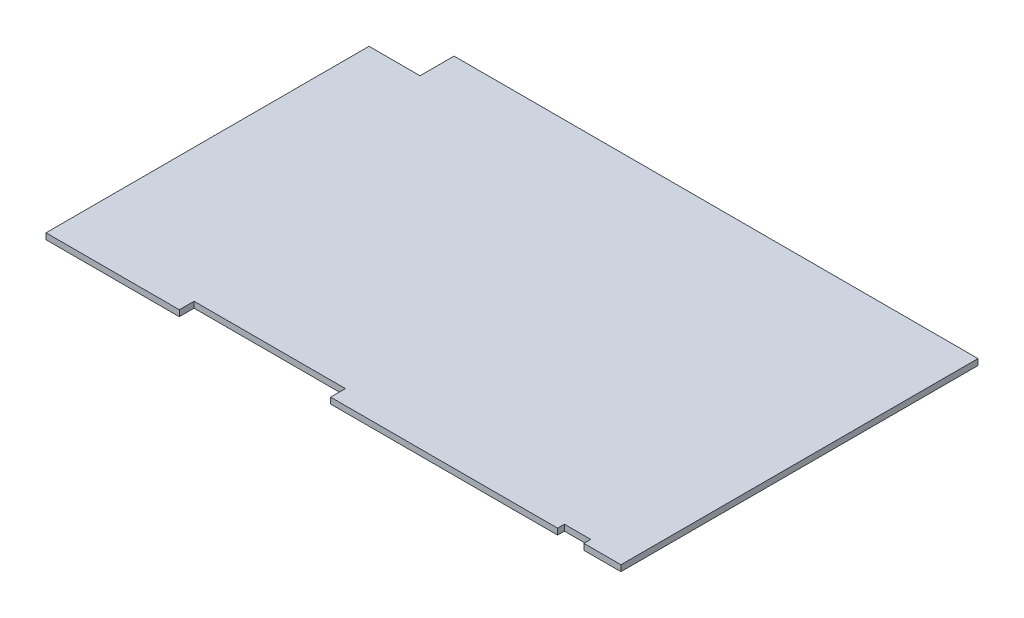
from build123d import *

# Parameters (mm, degrees)
BOSS_EXTRUDE1_DEPTH = 1.6


with BuildPart() as part:
    # Sketch1 → Boss-Extrude1 (new body)
    with BuildSketch(Plane(origin=(0, 0, 0), x_dir=(1, 0, 0), z_dir=(0, 1, 0))):
        Polygon((-76, 38.2), (-76, -47.2), (-40.74999921, -47.2), (-40.74999921, -43.299999968), (-0.74999921, -43.299999968), (-0.74999921, -47.2), (59.25000079, -47.2), (59.25000079, -45.39), (66.195, -45.39), (66.195, -47.2), (76, -47.2), (76, 47.2), (-62.517304486, 47.2), (-62.517304486, 38.2), align=None)
    extrude(amount=BOSS_EXTRUDE1_DEPTH)


solid = part.part
